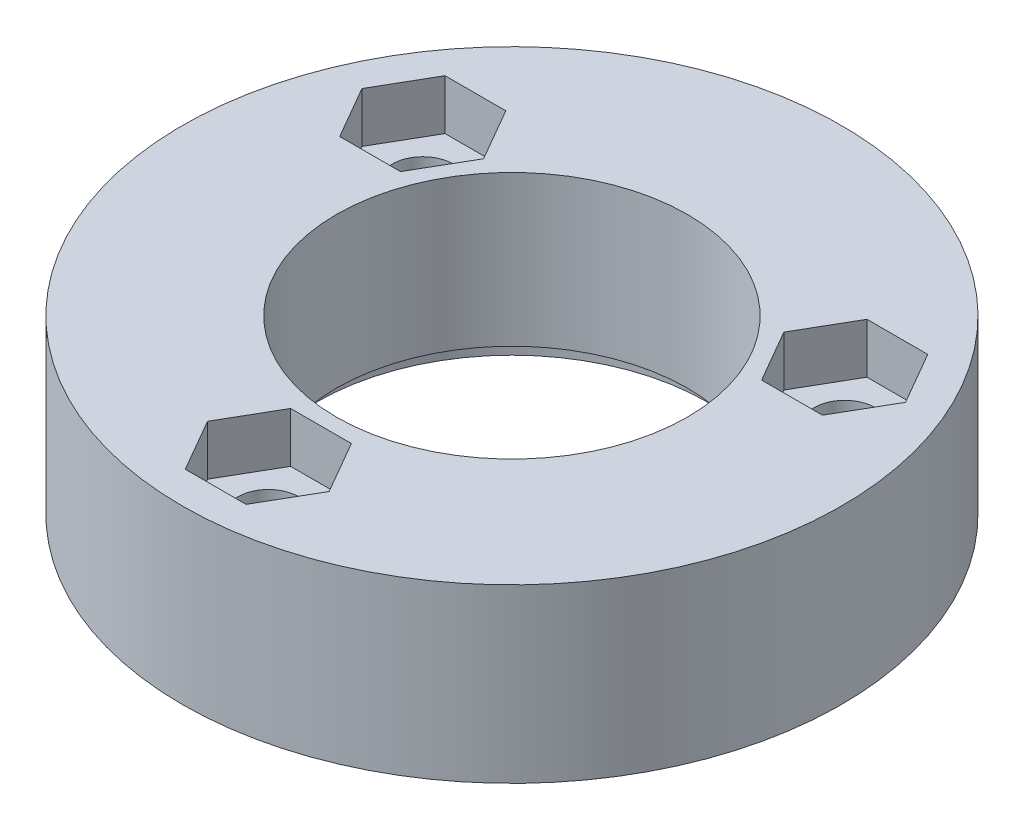
from build123d import *

# Parameters (mm, degrees)
SKETCH1_R           = 23
SKETCH1_R_2         = 12.25
BOSS_EXTRUDE1_DEPTH = 12
SKETCH2_R           = 13.6
CUT_EXTRUDE1_DEPTH  = 1.5
SKETCH3_R           = 2.125
CUT_EXTRUDE2_DEPTH  = 35.669871647
CUT_EXTRUDE3_DEPTH  = 3.5


with BuildPart() as part:
    # Sketch1 → Boss-Extrude1 (new body)
    with BuildSketch(Plane(origin=(0, 0, 0), x_dir=(1, 0, 0), z_dir=(0, 1, 0))):
        with Locations(Location((0, 0, 0), (0, 0, 270))):
            Circle(SKETCH1_R)
        with Locations(Location((0, 0, 0), (0, 0, 270))):
            Circle(SKETCH1_R_2, mode=Mode.SUBTRACT)
    extrude(amount=BOSS_EXTRUDE1_DEPTH)

    # Sketch2 → Cut-Extrude1 (cut)
    with BuildSketch(Plane.XZ):
        with Locations(Location((0, 0, 0), (0, 0, 270))):
            Circle(SKETCH2_R)
    extrude(amount=-CUT_EXTRUDE1_DEPTH, mode=Mode.SUBTRACT)

    # Sketch3 → Cut-Extrude2 (cut, through all)
    with BuildSketch(Plane(origin=(0, 12, 0), x_dir=(1, 0, 0), z_dir=(0, 1, 0))):
        with Locations(Location((0, -17, 0), (0, 0, 270))):
            Circle(SKETCH3_R)
        with Locations(Location((-14.722431864, 8.5, 0), (0, 0, 270))):
            Circle(SKETCH3_R)
        with Locations(Location((14.722431864, 8.5, 0), (0, 0, 270))):
            Circle(SKETCH3_R)
    extrude(amount=-CUT_EXTRUDE2_DEPTH, mode=Mode.SUBTRACT)

    # Sketch4 → Cut-Extrude3 (cut)
    with BuildSketch(Plane(origin=(0, 12, 0), x_dir=(1, 0, 0), z_dir=(0, 1, 0))):
        Polygon((-16.844194104, 4.825), (-12.600669625, 4.825), (-10.478907386, 8.5), (-12.600669625, 12.175), (-16.844194104, 12.175), (-18.965956343, 8.5), align=None)
        Polygon((4.243524479, -17), (2.121762239, -13.325), (-2.121762239, -13.325), (-4.243524479, -17), (-2.121762239, -20.675), (2.121762239, -20.675), align=None)
        Polygon((12.600669625, 12.175), (10.478907386, 8.5), (12.600669625, 4.825), (16.844194104, 4.825), (18.965956343, 8.5), (16.844194104, 12.175), align=None)
    extrude(amount=-CUT_EXTRUDE3_DEPTH, mode=Mode.SUBTRACT)


solid = part.part
